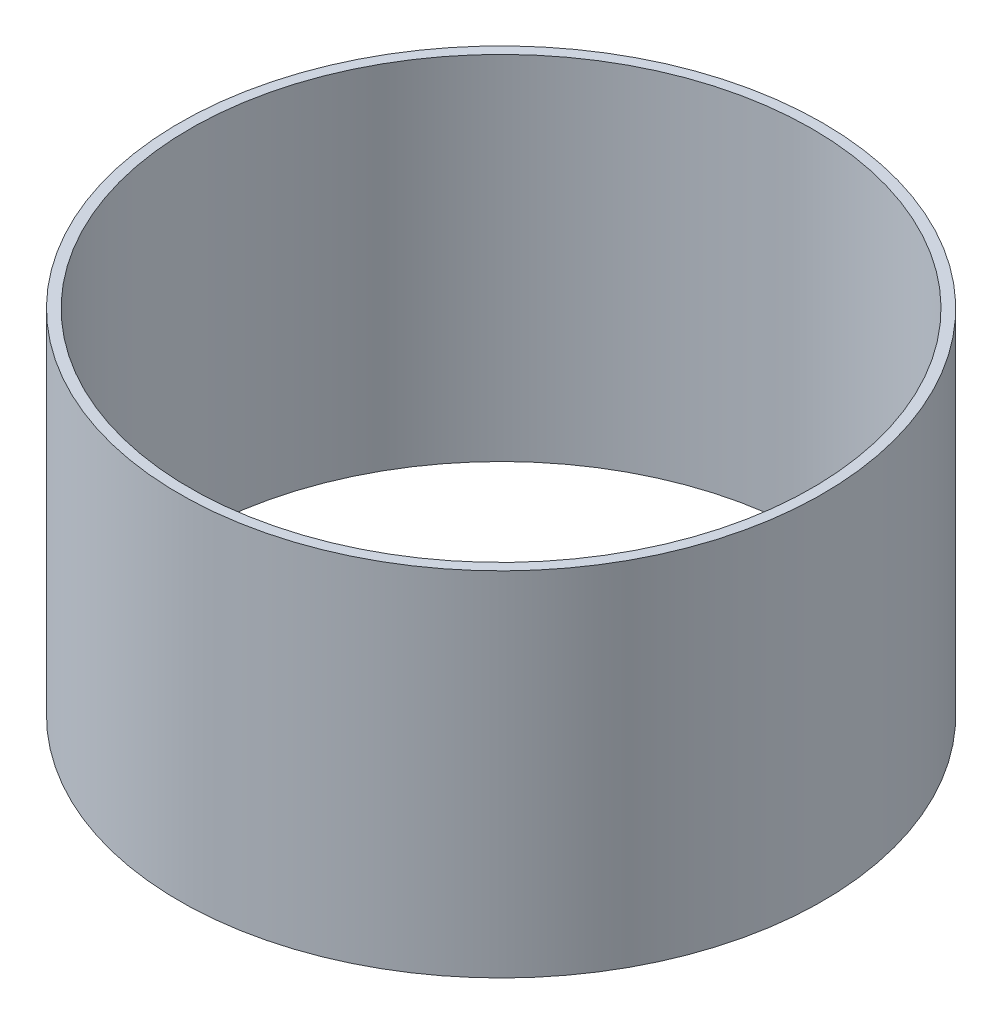
from build123d import *

# Parameters (mm, degrees)
SKETCH_1_W = 5
SKETCH_1_H = 170


with BuildPart() as part:
    # 草图1 → 旋转1 (revolve)
    with BuildSketch(Plane.XY, mode=Mode.PRIVATE) as revolve_1_sk:
        with Locations((152.5, 85)):
            Rectangle(SKETCH_1_W, SKETCH_1_H)
    revolve(revolve_1_sk.sketch.rotate(Axis((0, 0, 0), (0, 1, 0)), 90), axis=Axis((0, 0, 0), (0, 1, 0)))


solid = part.part
